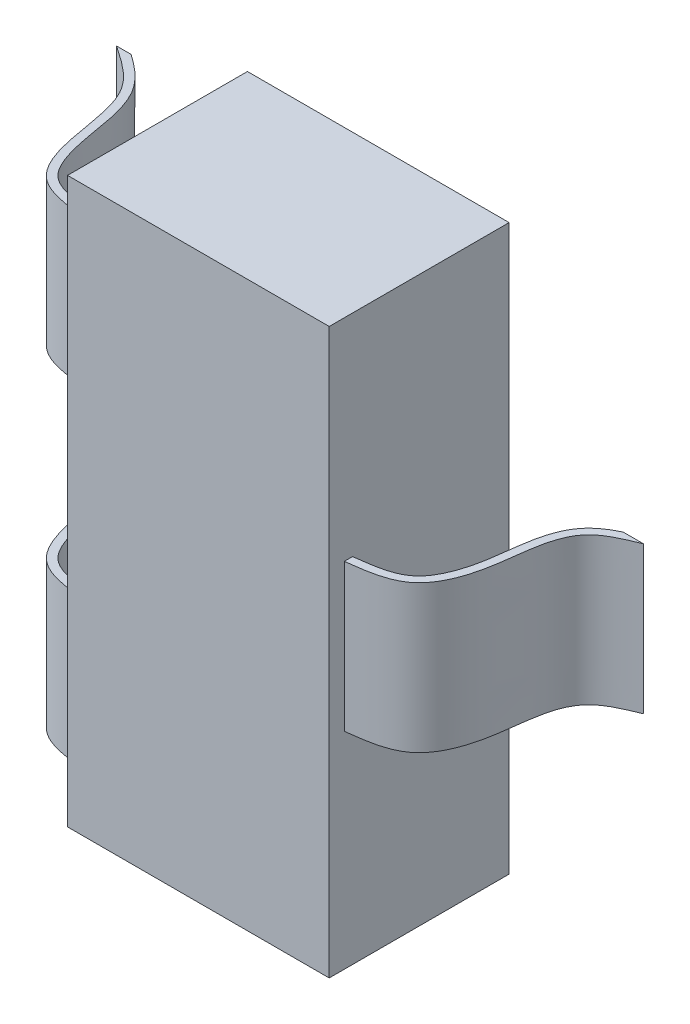
from build123d import *

# Parameters (mm, degrees)
EXTRUDE1_DEPTH     = 1.1
CUT_EXTRUDE1_DEPTH = 4.767190598
CUT_EXTRUDE2_DEPTH = 4.767190642


with BuildPart() as part:
    # COMPONENT_OUTLINE → Extrude1 (new body)
    with BuildSketch(Plane.XY):
        Polygon((-0.875, -1.71), (0.725, -1.71), (0.725, -0.45), (1.5475, -0.45), (1.5475, 0.45), (0.725, 0.45), (0.725, 1.74), (-0.875, 1.74), (-0.875, 1.475), (-1.675, 1.475), (-1.675, 0.575), (-0.875, 0.575), (-0.875, -0.55), (-1.675, -0.55), (-1.675, -1.45), (-0.875, -1.45), align=None)
    extrude(amount=EXTRUDE1_DEPTH)

    # Sketch1 → Cut-Extrude1 (cut, through all)
    with BuildSketch(Plane.XZ.offset(1.45)):
        with BuildLine():
            Line((0.725, 1.1), (1.5475, 1.1))
            Line((1.5475, 1.1), (1.5475, 0))
            add(Edge.make_bspline(
                [(0.725, 1.007684008), (0.841255766, 0.993236255), (1.074434419, 0.964257843), (1.240697247, 0.566279231), (1.212102737, 0.136753725), (1.466368993, 0.033080078), (1.5475, 0)],
                knots=[0, 0, 0, 0, 0.228895666, 0.459104825, 0.827411741, 1, 1, 1, 1], degree=3))
            Line((0.725, 1.007684008), (0.725, 1.1))
        make_face()
        with BuildLine():
            Line((-0.875, 1.1), (-0.875, 1.007684008))
            add(Edge.make_bspline(
                [(-0.875, 1.007684008), (-0.992502858, 0.993714751), (-1.247070824, 0.963450589), (-1.342415555, 0.56189323), (-1.384469235, 0.196400416), (-1.584715613, 0.061032749), (-1.675, 0)],
                knots=[0, 0, 0, 0, 0.232825369, 0.504412246, 0.776556075, 1, 1, 1, 1], degree=3))
            Line((-1.675, 0), (-1.675, 1.1))
            Line((-1.675, 1.1), (-0.875, 1.1))
        make_face()
    extrude(amount=-CUT_EXTRUDE1_DEPTH, mode=Mode.SUBTRACT)

    # Sketch2 → Cut-Extrude2 (cut, through all)
    with BuildSketch(Plane.XZ.offset(1.45)):
        with BuildLine():
            Line((0.725, 0), (1.421572568, 0))
            add(Edge.make_bspline(
                [(1.421572568, 0), (1.398439084, 0.011285624), (1.375838095, 0.023644995), (1.327364404, 0.055460599), (1.301887511, 0.076567597), (1.259910489, 0.125534473), (1.243394855, 0.152637933), (1.177610694, 0.294933575), (1.174271294, 0.429683105), (1.134079821, 0.680245939), (1.093633579, 0.798176416), (0.992225356, 0.893756481), (0.949632552, 0.913640339), (0.845445066, 0.941870469), (0.7862927, 0.949660717), (0.725, 0.957298469)],
                knots=[0.07541425, 0.07541425, 0.07541425, 0.07541425, 0.125, 0.125, 0.1875, 0.1875, 0.25, 0.25, 0.5, 0.5, 0.75, 0.75, 0.875, 0.875, 0.995948591, 0.995948591, 0.995948591, 0.995948591], degree=3))
            Line((0.725, 0.957298469), (0.725, 0))
        make_face()
        with BuildLine():
            Line((-1.586416297, 0), (-0.875, 0))
            Line((-0.875, 0), (-0.875, 0.957331048))
            add(Edge.make_bspline(
                [(-1.586416297, 0), (-1.555884998, 0.021384965), (-1.525710826, 0.043709629), (-1.449960416, 0.108153898), (-1.406998869, 0.155193673), (-1.317807524, 0.317989625), (-1.304878373, 0.44302641), (-1.260607801, 0.687731731), (-1.227980141, 0.806351912), (-1.137249482, 0.896473216), (-1.096849985, 0.915474598), (-0.994853528, 0.942624737), (-0.935985962, 0.950060656), (-0.875, 0.957331048)],
                knots=[0.049723417, 0.049723417, 0.049723417, 0.049723417, 0.125, 0.125, 0.25, 0.25, 0.5, 0.5, 0.75, 0.75, 0.875, 0.875, 0.996097337, 0.996097337, 0.996097337, 0.996097337], degree=3))
        make_face()
    extrude(amount=-CUT_EXTRUDE2_DEPTH, mode=Mode.SUBTRACT)


solid = part.part
